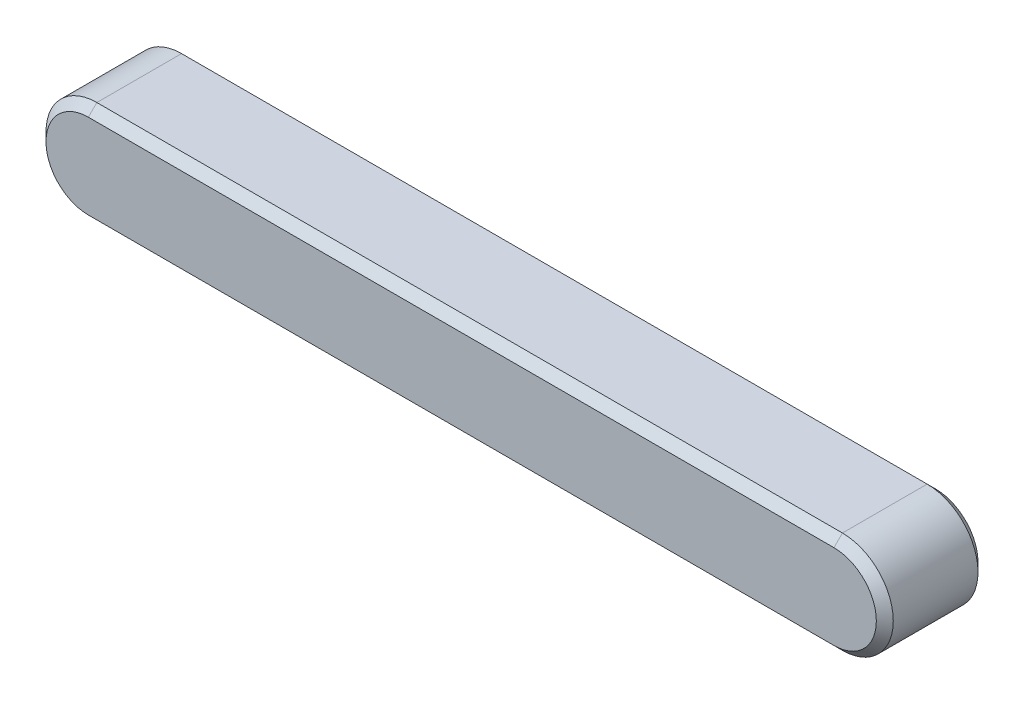
from build123d import *

# Parameters (mm, degrees)
BASEKEY_DEPTH = 1.5
CHAMFER1_SIZE = 0.25


with BuildPart() as part:
    # Sketch1 → BaseKey (new, symmetric)
    with BuildSketch(Plane.XY):
        with BuildLine():
            Line((-22, 1.5), (0, 1.5))
            ThreePointArc((0, 1.5), (1.5, 0), (0, -1.5))
            Line((0, -1.5), (-22, -1.5))
            ThreePointArc((-22, -1.5), (-23.5, 0), (-22, 1.5))
        make_face()
    extrude(amount=BASEKEY_DEPTH, both=True)

    # Chamfer1
    chamfer1_edges = [part.edges().sort_by_distance(p)[0] for p in [
        (1.5, 0, 1.5),
        (-11, 1.5, 1.5),
        (-23.5, 0, 1.5),
        (-11, 1.5, -1.5),
        (1.5, 0, -1.5),
        (-11, -1.5, -1.5),
        (-23.5, 0, -1.5),
        (-11, -1.5, 1.5),
    ]]
    chamfer(chamfer1_edges, length=CHAMFER1_SIZE)


solid = part.part
